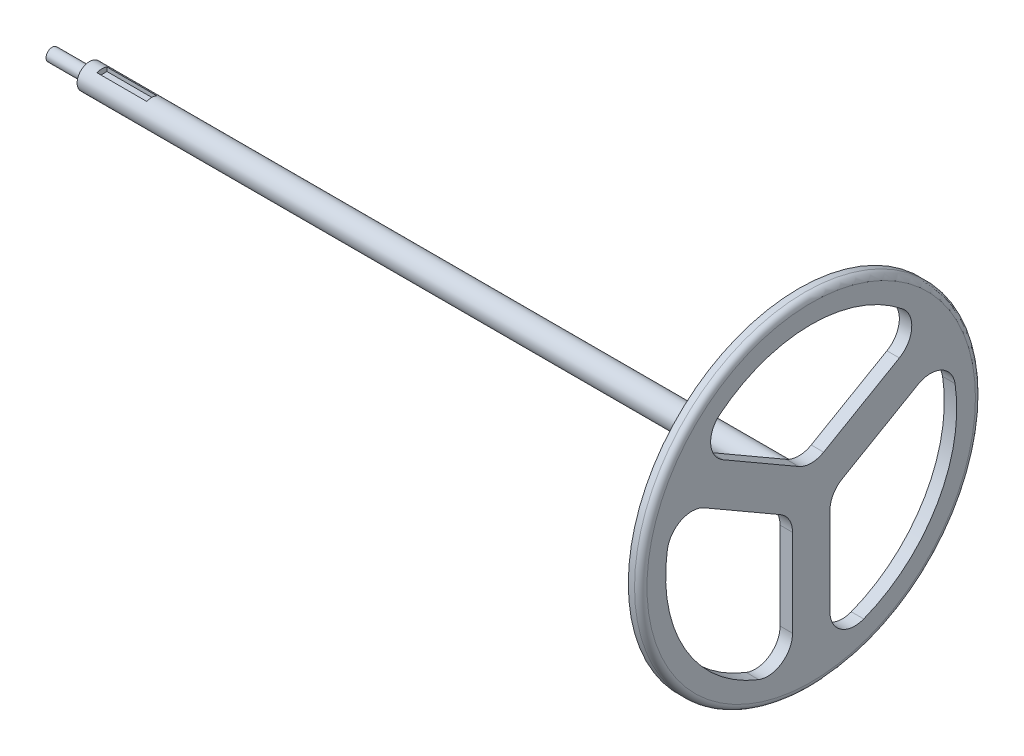
from build123d import *

# Parameters (mm, degrees)
SKETCH2_R           = 10
BOSS_EXTRUDE1_DEPTH = 580
SKETCH3_R           = 5
BOSS_EXTRUDE2_DEPTH = 30
CUT_EXTRUDE1_START  = -10
SKETCH8_W           = 8
SKETCH8_H           = 8
CUT_EXTRUDE1_DEPTH  = 40
SKETCH7_R           = 137
BOSS_EXTRUDE7_DEPTH = 10
FILLET1_R           = 5


with BuildPart() as part:
    # Sketch2 → Boss-Extrude1 (new body)
    with BuildSketch(Plane(origin=(0, 0, 0), x_dir=(0, 0, -1), z_dir=(1, 0, 0))):
        Circle(SKETCH2_R)
    extrude(amount=-BOSS_EXTRUDE1_DEPTH)

    # Sketch3 → Boss-Extrude2 (add)
    with BuildSketch(Plane.ZY.offset(580)):
        Circle(SKETCH3_R)
    extrude(amount=BOSS_EXTRUDE2_DEPTH)

    # Sketch8 → Cut-Extrude1 (cut)
    with BuildSketch(Plane.ZY.offset(580).offset(CUT_EXTRUDE1_START)):
        with Locations((0, 10)):
            Rectangle(SKETCH8_W, SKETCH8_H)
    extrude(amount=-CUT_EXTRUDE1_DEPTH, mode=Mode.SUBTRACT)

    # Sketch7 → Boss-Extrude7 (add)
    with BuildSketch(Plane(origin=(0, 0, 0), x_dir=(0, 0, -1), z_dir=(1, 0, 0))):
        Circle(SKETCH7_R)
        with BuildLine():
            Line((-10, 23.094010768), (-70.845389143, 58.223112568))
            ThreePointArc((-70.845389143, 58.223112568), (-80.785784301, 74.000688066), (-73.390830204, 91.119624901))
            ThreePointArc((-73.390830204, 91.119624901), (0, 117), (73.390830204, 91.119624901))
            ThreePointArc((73.390830204, 91.119624901), (80.785784301, 74.000688066), (70.845389143, 58.223112568))
            Line((70.845389143, 58.223112568), (10, 23.094010768))
            ThreePointArc((10, 23.094010768), (0, 20.414518843), (-10, 23.094010768))
        make_face(mode=Mode.SUBTRACT)
        with BuildLine():
            Line((-15, -20.207259422), (-15, -90.465463023))
            ThreePointArc((-15, -90.465463023), (-23.693583612, -106.962885502), (-42.216494845, -109.118135811))
            ThreePointArc((-42.216494845, -109.118135811), (-101.324972243, -58.5), (-115.607325049, 17.998510911))
            ThreePointArc((-115.607325049, 17.998510911), (-104.479367913, 32.962197437), (-85.845389143, 32.242350455))
            Line((-85.845389143, 32.242350455), (-25, -2.886751346))
            ThreePointArc((-25, -2.886751346), (-17.679491924, -10.207259422), (-15, -20.207259422))
        make_face(mode=Mode.SUBTRACT)
        with BuildLine():
            Line((25, -2.886751346), (85.845389143, 32.242350455))
            ThreePointArc((85.845389143, 32.242350455), (104.479367913, 32.962197437), (115.607325049, 17.998510911))
            ThreePointArc((115.607325049, 17.998510911), (101.324972243, -58.5), (42.216494845, -109.118135811))
            ThreePointArc((42.216494845, -109.118135811), (23.693583612, -106.962885502), (15, -90.465463023))
            Line((15, -90.465463023), (15, -20.207259422))
            ThreePointArc((15, -20.207259422), (17.679491924, -10.207259422), (25, -2.886751346))
        make_face(mode=Mode.SUBTRACT)
    extrude(amount=-BOSS_EXTRUDE7_DEPTH)

    # Fillet1
    fillet1_edges = [part.edges().sort_by_distance(p)[0] for p in [
        (0, 0, 137),
    ]]
    fillet(fillet1_edges, radius=FILLET1_R)


solid = part.part
